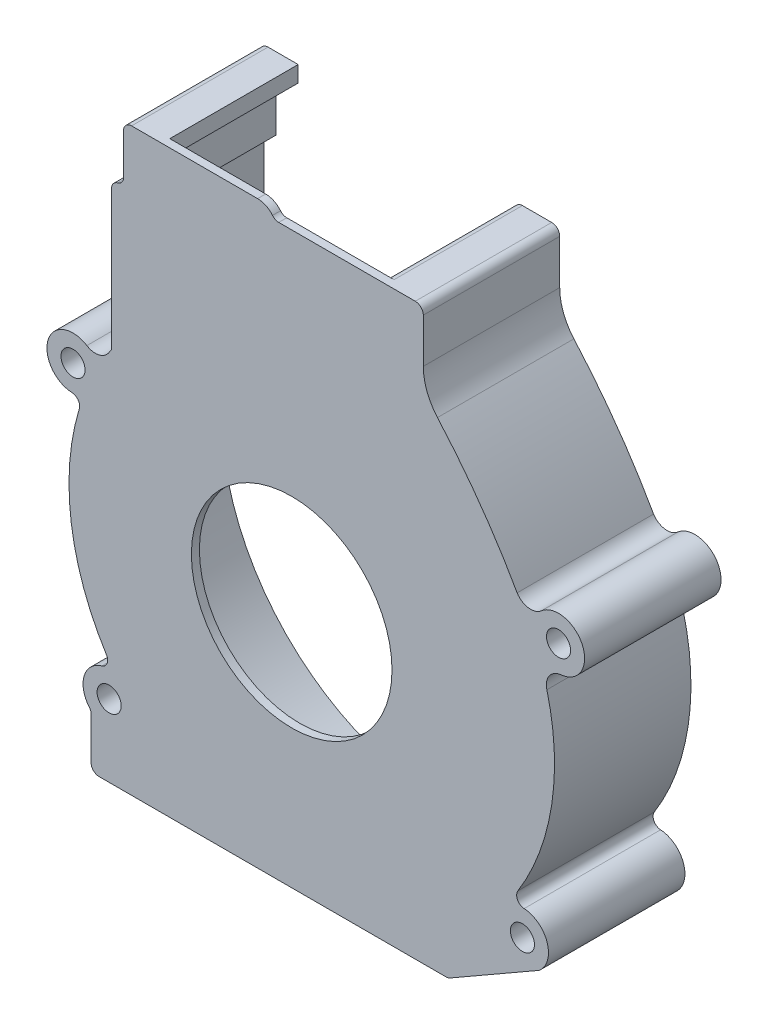
from build123d import *

# Parameters (mm, degrees)
SKETCH1_R           = 3
BOSS_EXTRUDE1_DEPTH = 32
SKETCH2_R           = 25
SKETCH2_R_2         = 3
BOSS_EXTRUDE2_DEPTH = 2
CUT_EXTRUDE3_START  = -43.5
CUT_EXTRUDE3_DEPTH  = 43.5
BOSS_EXTRUDE3_START = -2
BOSS_EXTRUDE3_DEPTH = 2
FILLET3_R           = 2


with BuildPart() as part:
    # Sketch1 → Boss-Extrude1 (new body)
    with BuildSketch(Plane.XY):
        with BuildLine():
            Line((-53, -59.5), (-5, -59.5))
            Line((-5, -59.5), (33.466899887, -59.5))
            ThreePointArc((33.466899887, -59.5), (33.982014794, -59.432525972), (34.462372823, -59.234656633))
            Line((34.462372823, -59.234656633), (54.72098291, -47.608783423))
            Line((54.72098291, -47.608783423), (56.653811778, -46.499584754))
            ThreePointArc((56.653811778, -46.499584754), (58.683573084, -39.496646832), (52.932852386, -35.014428413))
            ThreePointArc((52.932852386, -35.014428413), (51.286335437, -33.93136983), (51.367924528, -31.962264151))
            ThreePointArc((51.367924528, -31.962264151), (59.796951453, -9.196444799), (58.598166416, 15.05007949))
            ThreePointArc((58.598166416, 15.05007949), (59.201470515, 18.347484522), (62.101977599, 20.027935185))
            ThreePointArc((62.101977599, 20.027935185), (67.46941068, 29.07218509), (57.209308895, 31.382619158))
            ThreePointArc((57.209308895, 31.382619158), (53.995797744, 30.428574159), (51.184766788, 32.254761647))
            ThreePointArc((51.184766788, 32.254761647), (42.003181209, 46.735407793), (31.327057509, 60.152225945))
            ThreePointArc((31.327057509, 60.152225945), (28.711432567, 64.474102627), (27.8, 69.442945809))
            Line((27.8, 69.442945809), (27.8, 80.5))
            ThreePointArc((27.8, 80.5), (27.214213562, 81.914213562), (25.8, 82.5))
            Line((25.8, 82.5), (18.5, 82.5))
            ThreePointArc((18.5, 82.5), (17.085786438, 81.914213562), (16.5, 80.5))
            Line((16.5, 80.5), (16.5, 78.5))
            Line((16.5, 78.5), (21.8, 78.5))
            ThreePointArc((21.8, 78.5), (23.214213562, 77.914213562), (23.8, 76.5))
            Line((23.8, 76.5), (23.8, 66.810649809))
            ThreePointArc((23.8, 66.810649809), (24.771773344, 61.685680521), (27.552187173, 57.272183881))
            ThreePointArc((27.552187173, 57.272183881), (30.688635385, 53.798817753), (33.71882223, 50.232370314))
            ThreePointArc((33.71882223, 50.232370314), (41.435950887, 40.650801907), (47.800649975, 30.122215422))
            ThreePointArc((47.800649975, 30.122215422), (-6.814518891, -56.087541685), (-39.196843269, 40.692228715))
            ThreePointArc((-39.196843269, 40.692228715), (-37.08221818, 41.75647487), (-34.736286869, 41.438881683))
            ThreePointArc((-34.736286869, 41.438881683), (-27.633151067, 48.108450504), (-37.376275293, 48.204454676))
            ThreePointArc((-37.376275293, 48.204454676), (-37.855586541, 47.355396867), (-38.526075168, 46.647524395))
            ThreePointArc((-38.526075168, 46.647524395), (-39.712733241, 45.641525156), (-40.87313288, 44.605347309))
            ThreePointArc((-40.87313288, 44.605347309), (-44.108142168, 44.071249287), (-45.899899799, 46.817182713))
            Line((-45.899899799, 46.817182713), (-45.899899799, 65))
            ThreePointArc((-45.899899799, 65), (-45.314113362, 66.414213562), (-43.899899799, 67))
            Line((-43.899899799, 67), (-42.899899799, 67))
            Line((-42.899899799, 67), (-42.899899799, 79))
            ThreePointArc((-42.899899799, 79), (-42.314113362, 80.414213562), (-40.899899799, 81))
            Line((-40.899899799, 81), (-20.193280212, 81))
            ThreePointArc((-20.193280212, 81), (-18.909902316, 80.533929978), (-18.224668385, 79.352941176))
            ThreePointArc((-18.224668385, 79.352941176), (-14.448760929, 75.49469951), (-9.472757132, 77.588235294))
            ThreePointArc((-9.472757132, 77.588235294), (-8.74960298, 78.257337558), (-7.79473927, 78.5))
            Line((-7.79473927, 78.5), (-5, 78.5))
            Line((-5, 78.5), (-3.5, 78.5))
            Line((-3.5, 78.5), (-3.5, 82.5))
            Line((-3.5, 82.5), (-5, 82.5))
            Line((-5, 82.5), (-8.232173124, 82.5))
            ThreePointArc((-8.232173124, 82.5), (-9.089666049, 82.693150288), (-9.78153397, 83.235294118))
            ThreePointArc((-9.78153397, 83.235294118), (-11.442016978, 84.536439309), (-13.5, 85))
            Line((-13.5, 85), (-44.899899799, 85))
            ThreePointArc((-44.899899799, 85), (-46.314113362, 84.414213562), (-46.899899799, 83))
            Line((-46.899899799, 83), (-46.899899799, 71))
            Line((-46.899899799, 71), (-47.899899799, 71))
            ThreePointArc((-47.899899799, 71), (-49.314113362, 70.414213562), (-49.899899799, 69))
            Line((-49.899899799, 69), (-49.899899799, 34.208916966))
            ThreePointArc((-49.899899799, 34.208916966), (-50.240874628, 33.706149537), (-50.576784, 33.199983739))
            ThreePointArc((-50.576784, 33.199983739), (-53.06788243, 31.486994298), (-56.046149849, 32.00644342))
            ThreePointArc((-56.046149849, 32.00644342), (-65.708375749, 28.425115726), (-59.767444663, 20.00550438))
            ThreePointArc((-59.767444663, 20.00550438), (-58.220458323, 19.167136154), (-57.934543798, 17.430967699))
            ThreePointArc((-57.934543798, 17.430967699), (-59.948169649, -8.152726891), (-51.175463245, -32.26952063))
            ThreePointArc((-51.175463245, -32.26952063), (-50.997534258, -34.046420575), (-52.310222544, -35.25715655))
            ThreePointArc((-52.310222544, -35.25715655), (-56.720764111, -39.615300058), (-55.470588235, -45.688466616))
            ThreePointArc((-55.470588235, -45.688466616), (-55.121327127, -46.291231234), (-55, -46.977225575))
            Line((-55, -46.977225575), (-55, -57.5))
            ThreePointArc((-55, -57.5), (-54.414213562, -58.914213562), (-53, -59.5))
        make_face()
        with Locations((-50.5, -41.5)):
            Circle(SKETCH1_R, mode=Mode.SUBTRACT)
        with Locations((52.5, -41.5)):
            Circle(SKETCH1_R, mode=Mode.SUBTRACT)
        with Locations((-59.5, 26.5)):
            Circle(SKETCH1_R, mode=Mode.SUBTRACT)
        with Locations((-32.523991145, 46.2)):
            Circle(SKETCH1_R, mode=Mode.SUBTRACT)
        with Locations((-13.5, 80.2)):
            Circle(SKETCH1_R, mode=Mode.SUBTRACT)
        with Locations((61.5, 26.5)):
            Circle(SKETCH1_R, mode=Mode.SUBTRACT)
    extrude(amount=BOSS_EXTRUDE1_DEPTH)

    # Sketch2 → Boss-Extrude2 (add)
    # profile 1 of 2: a face of its own
    with BuildSketch(Plane.XY.offset(32)):
        with BuildLine():
            Line((18.5, 82.5), (-3.5, 82.5))
            Line((-3.5, 82.5), (-3.5, 78.5))
            Line((-3.5, 78.5), (-7.79473927, 78.5))
            ThreePointArc((-7.79473927, 78.5), (-8.74960298, 78.257337558), (-9.472757132, 77.588235294))
            ThreePointArc((-9.472757132, 77.588235294), (-14.448760929, 75.49469951), (-18.224668385, 79.352941176))
            ThreePointArc((-18.224668385, 79.352941176), (-18.909902316, 80.533929978), (-20.193280212, 81))
            Line((-20.193280212, 81), (-40.899899799, 81))
            ThreePointArc((-40.899899799, 81), (-42.314113362, 80.414213562), (-42.899899799, 79))
            Line((-42.899899799, 79), (-42.899899799, 67))
            Line((-42.899899799, 67), (-43.899899799, 67))
            ThreePointArc((-43.899899799, 67), (-45.314113362, 66.414213562), (-45.899899799, 65))
            Line((-45.899899799, 65), (-45.899899799, 46.817182713))
            ThreePointArc((-45.899899799, 46.817182713), (-44.108142168, 44.071249287), (-40.87313288, 44.605347309))
            ThreePointArc((-40.87313288, 44.605347309), (-39.712733241, 45.641525156), (-38.526075168, 46.647524395))
            ThreePointArc((-38.526075168, 46.647524395), (-37.855586541, 47.355396867), (-37.376275293, 48.204454676))
            ThreePointArc((-37.376275293, 48.204454676), (-27.633151067, 48.108450504), (-34.736286869, 41.438881683))
            ThreePointArc((-34.736286869, 41.438881683), (-37.08221818, 41.75647487), (-39.196843269, 40.692228715))
            ThreePointArc((-39.196843269, 40.692228715), (-6.814518891, -56.087541685), (47.800649975, 30.122215422))
            ThreePointArc((47.800649975, 30.122215422), (41.435950887, 40.650801907), (33.71882223, 50.232370314))
            ThreePointArc((33.71882223, 50.232370314), (30.688635385, 53.798817753), (27.552187173, 57.272183881))
            ThreePointArc((27.552187173, 57.272183881), (24.771773344, 61.685680521), (23.8, 66.810649809))
            Line((23.8, 66.810649809), (23.8, 76.5))
            ThreePointArc((23.8, 76.5), (23.214213562, 77.914213562), (21.8, 78.5))
            Line((21.8, 78.5), (16.5, 78.5))
            Line((16.5, 78.5), (16.5, 80.5))
            ThreePointArc((16.5, 80.5), (17.085786438, 81.914213562), (18.5, 82.5))
        make_face()
        with Locations((-5, 0)):
            Circle(SKETCH2_R, mode=Mode.SUBTRACT)
    # profile 2 of 2: a face of its own
    with BuildSketch(Plane.XY.offset(32)):
        with BuildLine():
            Line((-3.5, 78.5), (-3.5, 82.5))
            Line((-3.5, 82.5), (-8.232173124, 82.5))
            ThreePointArc((-8.232173124, 82.5), (-9.089666049, 82.693150288), (-9.78153397, 83.235294118))
            ThreePointArc((-9.78153397, 83.235294118), (-11.442016978, 84.536439309), (-13.5, 85))
            Line((-13.5, 85), (-44.899899799, 85))
            ThreePointArc((-44.899899799, 85), (-46.314113362, 84.414213562), (-46.899899799, 83))
            Line((-46.899899799, 83), (-46.899899799, 71))
            Line((-46.899899799, 71), (-47.899899799, 71))
            ThreePointArc((-47.899899799, 71), (-49.314113362, 70.414213562), (-49.899899799, 69))
            Line((-49.899899799, 69), (-49.899899799, 34.208916966))
            ThreePointArc((-49.899899799, 34.208916966), (-50.240874628, 33.706149537), (-50.576784, 33.199983739))
            ThreePointArc((-50.576784, 33.199983739), (-53.06788243, 31.486994298), (-56.046149849, 32.00644342))
            ThreePointArc((-56.046149849, 32.00644342), (-65.708375749, 28.425115726), (-59.767444663, 20.00550438))
            ThreePointArc((-59.767444663, 20.00550438), (-58.220458323, 19.167136154), (-57.934543798, 17.430967699))
            ThreePointArc((-57.934543798, 17.430967699), (-59.948169649, -8.152726891), (-51.175463245, -32.26952063))
            ThreePointArc((-51.175463245, -32.26952063), (-50.997534258, -34.046420575), (-52.310222544, -35.25715655))
            ThreePointArc((-52.310222544, -35.25715655), (-56.720764111, -39.615300058), (-55.470588235, -45.688466616))
            ThreePointArc((-55.470588235, -45.688466616), (-55.121327127, -46.291231234), (-55, -46.977225575))
            Line((-55, -46.977225575), (-55, -57.5))
            ThreePointArc((-55, -57.5), (-54.414213562, -58.914213562), (-53, -59.5))
            Line((-53, -59.5), (33.466899887, -59.5))
            ThreePointArc((33.466899887, -59.5), (33.982014794, -59.432525972), (34.462372823, -59.234656633))
            Line((34.462372823, -59.234656633), (56.653811778, -46.499584754))
            ThreePointArc((56.653811778, -46.499584754), (58.683573084, -39.496646832), (52.932852386, -35.014428413))
            ThreePointArc((52.932852386, -35.014428413), (51.286335437, -33.93136983), (51.367924528, -31.962264151))
            ThreePointArc((51.367924528, -31.962264151), (59.796951453, -9.196444799), (58.598166416, 15.05007949))
            ThreePointArc((58.598166416, 15.05007949), (59.201470515, 18.347484522), (62.101977599, 20.027935185))
            ThreePointArc((62.101977599, 20.027935185), (67.46941068, 29.07218509), (57.209308895, 31.382619158))
            ThreePointArc((57.209308895, 31.382619158), (53.995797744, 30.428574159), (51.184766788, 32.254761647))
            ThreePointArc((51.184766788, 32.254761647), (42.003181209, 46.735407793), (31.327057509, 60.152225945))
            ThreePointArc((31.327057509, 60.152225945), (28.711432567, 64.474102627), (27.8, 69.442945809))
            Line((27.8, 69.442945809), (27.8, 80.5))
            ThreePointArc((27.8, 80.5), (27.214213562, 81.914213562), (25.8, 82.5))
            Line((25.8, 82.5), (18.5, 82.5))
            ThreePointArc((18.5, 82.5), (17.085786438, 81.914213562), (16.5, 80.5))
            Line((16.5, 80.5), (16.5, 78.5))
            Line((16.5, 78.5), (21.8, 78.5))
            ThreePointArc((21.8, 78.5), (23.214213562, 77.914213562), (23.8, 76.5))
            Line((23.8, 76.5), (23.8, 66.810649809))
            ThreePointArc((23.8, 66.810649809), (24.771773344, 61.685680521), (27.552187173, 57.272183881))
            ThreePointArc((27.552187173, 57.272183881), (30.688635385, 53.798817753), (33.71882223, 50.232370314))
            ThreePointArc((33.71882223, 50.232370314), (41.435950887, 40.650801907), (47.800649975, 30.122215422))
            ThreePointArc((47.800649975, 30.122215422), (-6.814518891, -56.087541685), (-39.196843269, 40.692228715))
            ThreePointArc((-39.196843269, 40.692228715), (-37.08221818, 41.75647487), (-34.736286869, 41.438881683))
            ThreePointArc((-34.736286869, 41.438881683), (-27.633151067, 48.108450504), (-37.376275293, 48.204454676))
            ThreePointArc((-37.376275293, 48.204454676), (-37.855586541, 47.355396867), (-38.526075168, 46.647524395))
            ThreePointArc((-38.526075168, 46.647524395), (-39.712733241, 45.641525156), (-40.87313288, 44.605347309))
            ThreePointArc((-40.87313288, 44.605347309), (-44.108142168, 44.071249287), (-45.899899799, 46.817182713))
            Line((-45.899899799, 46.817182713), (-45.899899799, 65))
            ThreePointArc((-45.899899799, 65), (-45.314113362, 66.414213562), (-43.899899799, 67))
            Line((-43.899899799, 67), (-42.899899799, 67))
            Line((-42.899899799, 67), (-42.899899799, 79))
            ThreePointArc((-42.899899799, 79), (-42.314113362, 80.414213562), (-40.899899799, 81))
            Line((-40.899899799, 81), (-20.193280212, 81))
            ThreePointArc((-20.193280212, 81), (-18.909902316, 80.533929978), (-18.224668385, 79.352941176))
            ThreePointArc((-18.224668385, 79.352941176), (-14.448760929, 75.49469951), (-9.472757132, 77.588235294))
            ThreePointArc((-9.472757132, 77.588235294), (-8.74960298, 78.257337558), (-7.79473927, 78.5))
            Line((-7.79473927, 78.5), (-3.5, 78.5))
        make_face()
        with Locations((-50.5, -41.5)):
            Circle(SKETCH2_R_2, mode=Mode.SUBTRACT)
        with Locations((52.5, -41.5)):
            Circle(SKETCH2_R_2, mode=Mode.SUBTRACT)
        with Locations((-59.5, 26.5)):
            Circle(SKETCH2_R_2, mode=Mode.SUBTRACT)
        with Locations((-32.523991145, 46.2)):
            Circle(SKETCH2_R_2, mode=Mode.SUBTRACT)
        with Locations((-13.5, 80.2)):
            Circle(SKETCH2_R_2, mode=Mode.SUBTRACT)
        with Locations((61.5, 26.5)):
            Circle(SKETCH2_R_2, mode=Mode.SUBTRACT)
    extrude(amount=BOSS_EXTRUDE2_DEPTH)

    # Sketch3 → Cut-Extrude3 (cut)
    with BuildSketch(Plane.XY.offset(34).offset(CUT_EXTRUDE3_START)):
        with BuildLine():
            Line((-3.5, 82.5), (16.5, 82.5))
            Line((16.5, 82.5), (16.5, 46.481693385))
            ThreePointArc((16.5, 46.481693385), (15.627802553, 44.36687512), (13.518362469, 43.481749583))
            Line((13.518362469, 43.481749583), (-22.529300144, 43.261104089))
            ThreePointArc((-22.529300144, 43.261104089), (-24.003633635, 42.86343982), (-25.091226832, 41.791554962))
            ThreePointArc((-25.091226832, 41.791554962), (-33.658943745, 37.633071987), (-40.848269224, 43.879058931))
            Line((-40.848269224, 43.879058931), (-45.899899799, 48.190532346))
            Line((-45.899899799, 48.190532346), (-45.899899799, 65))
            ThreePointArc((-45.899899799, 65), (-45.314113362, 66.414213562), (-43.899899799, 67))
            Line((-43.899899799, 67), (-42.899899799, 67))
            Line((-42.899899799, 67), (-42.899899799, 79))
            ThreePointArc((-42.899899799, 79), (-42.314113362, 80.414213562), (-40.899899799, 81))
            Line((-40.899899799, 81), (-37.376275293, 81))
            Line((-37.376275293, 81), (-37.376275293, 85))
            Line((-37.376275293, 85), (-13.5, 85))
            ThreePointArc((-13.5, 85), (-11.442016978, 84.536439309), (-9.78153397, 83.235294118))
            ThreePointArc((-9.78153397, 83.235294118), (-9.089666049, 82.693150288), (-8.232173124, 82.5))
            Line((-8.232173124, 82.5), (-5, 82.5))
            Line((-5, 82.5), (-3.5, 82.5))
        make_face()
    extrude(amount=CUT_EXTRUDE3_DEPTH, mode=Mode.SUBTRACT)

    # Sketch5 → Boss-Extrude3 (add)
    with BuildSketch(Plane.XY.offset(34).offset(BOSS_EXTRUDE3_START)):
        with BuildLine():
            Line((-3.5, 82.5), (16.5, 82.5))
            Line((16.5, 82.5), (16.5, 46.481693385))
            ThreePointArc((16.5, 46.481693385), (15.627802553, 44.36687512), (13.518362469, 43.481749583))
            Line((13.518362469, 43.481749583), (-22.529300144, 43.261104089))
            ThreePointArc((-22.529300144, 43.261104089), (-24.003633635, 42.86343982), (-25.091226832, 41.791554962))
            ThreePointArc((-25.091226832, 41.791554962), (-33.658943745, 37.633071987), (-40.848269224, 43.879058931))
            Line((-40.848269224, 43.879058931), (-45.899899799, 48.190532346))
            Line((-45.899899799, 48.190532346), (-45.899899799, 65))
            ThreePointArc((-45.899899799, 65), (-45.314113362, 66.414213562), (-43.899899799, 67))
            Line((-43.899899799, 67), (-42.899899799, 67))
            Line((-42.899899799, 67), (-42.899899799, 79))
            ThreePointArc((-42.899899799, 79), (-42.314113362, 80.414213562), (-40.899899799, 81))
            Line((-40.899899799, 81), (-37.376275293, 81))
            Line((-37.376275293, 81), (-37.376275293, 85))
            Line((-37.376275293, 85), (-13.5, 85))
            ThreePointArc((-13.5, 85), (-11.442016978, 84.536439309), (-9.78153397, 83.235294118))
            ThreePointArc((-9.78153397, 83.235294118), (-9.089666049, 82.693150288), (-8.232173124, 82.5))
            Line((-8.232173124, 82.5), (-5, 82.5))
            Line((-5, 82.5), (-3.5, 82.5))
        make_face()
    extrude(amount=BOSS_EXTRUDE3_DEPTH)

    # Fillet3
    fillet3_edges = [part.edges().sort_by_distance(p)[0] for p in [
        (-46.899899799, 71, 17),
    ]]
    fillet(fillet3_edges, radius=FILLET3_R)


solid = part.part
